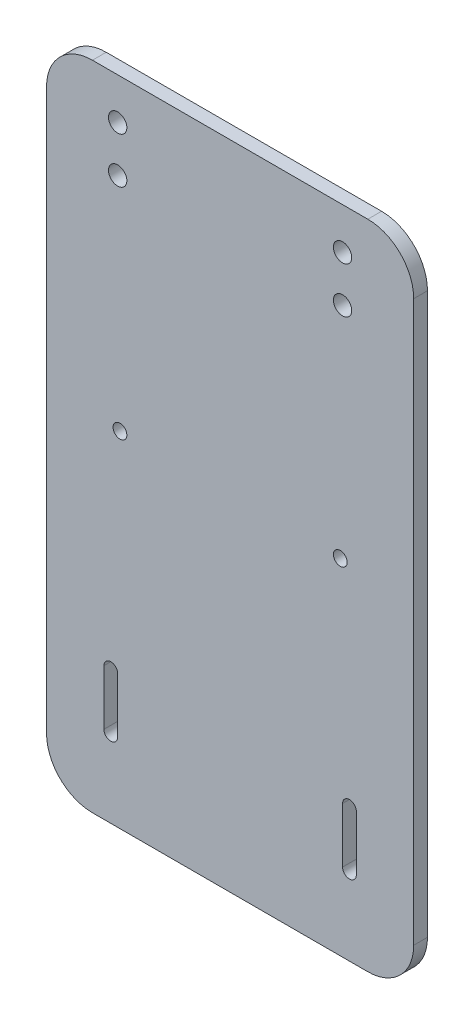
from build123d import *

# Parameters (mm, degrees)
SKETCH_1_W          = 80
SKETCH_1_H          = 150
SKETCH_1_R          = 1.5
EXTRUDE_1_DEPTH     = 3
CUT_EXTRUDE_START   = -10
CUT_EXTRUDE_1_DEPTH = 10
SKETCH_3_R          = 2
CUT_EXTRUDE_2_DEPTH = 10
SKETCH_4_W          = 87.19
SKETCH_4_H          = 8
CUT_EXTRUDE_3_DEPTH = 10
FILLET_1_R          = 10


with BuildPart() as part:
    # 草图1 → 凸台-拉伸1 (new body)
    with BuildSketch(Plane.XY):
        Rectangle(SKETCH_1_W, SKETCH_1_H)
        with Locations((24, 0)):
            Circle(SKETCH_1_R, mode=Mode.SUBTRACT)
        with Locations(Location((-24, 0, 0), (0, 0, 180))):
            Circle(SKETCH_1_R, mode=Mode.SUBTRACT)
        with Locations((24.5, 48)):
            Circle(SKETCH_1_R, mode=Mode.SUBTRACT)
        with Locations((-24.5, 48)):
            Circle(SKETCH_1_R, mode=Mode.SUBTRACT)
        with Locations((26, -58)):
            Circle(SKETCH_1_R, mode=Mode.SUBTRACT)
        with Locations((-26, -58)):
            Circle(SKETCH_1_R, mode=Mode.SUBTRACT)
    extrude(amount=EXTRUDE_1_DEPTH)

    # 草图2 → 切除-拉伸1 (cut)
    with BuildSketch(Plane.XY.offset(3).offset(CUT_EXTRUDE_START)):
        with BuildLine():
            Line((-27.5, -58), (-27.5, -46))
            ThreePointArc((-27.5, -46), (-26, -44.5), (-24.5, -46))
            Line((-24.5, -46), (-24.5, -58))
            ThreePointArc((-24.5, -58), (-26, -59.5), (-27.5, -58))
        make_face()
        with BuildLine():
            Line((27.5, -58), (27.5, -46))
            ThreePointArc((27.5, -46), (26, -44.5), (24.5, -46))
            Line((24.5, -46), (24.5, -58))
            ThreePointArc((24.5, -58), (26, -59.5), (27.5, -58))
        make_face()
    extrude(amount=CUT_EXTRUDE_1_DEPTH, mode=Mode.SUBTRACT)

    # 草图3 → 切除-拉伸2 (cut)
    with BuildSketch(Plane.XY.offset(3)):
        with Locations((24.5, 58)):
            Circle(SKETCH_3_R)
        with Locations((24.5, 48)):
            Circle(SKETCH_3_R)
        with Locations((-24.5, 48)):
            Circle(SKETCH_3_R)
        with Locations((-24.5, 58)):
            Circle(SKETCH_3_R)
    extrude(amount=-CUT_EXTRUDE_2_DEPTH, mode=Mode.SUBTRACT)

    # 草图4 → 切除-拉伸3 (cut)
    with BuildSketch(Plane.XY.offset(3)):
        with Locations((3.595, 71)):
            Rectangle(SKETCH_4_W, SKETCH_4_H)
    extrude(amount=-CUT_EXTRUDE_3_DEPTH, mode=Mode.SUBTRACT)

    # 圆角1
    fillet_1_edges = [part.edges().sort_by_distance(p)[0] for p in [
        (-40, 67, 1.5),
        (40, 67, 1.5),
        (40, -75, 1.5),
        (-40, -75, 1.5),
    ]]
    fillet(fillet_1_edges, radius=FILLET_1_R)


solid = part.part
